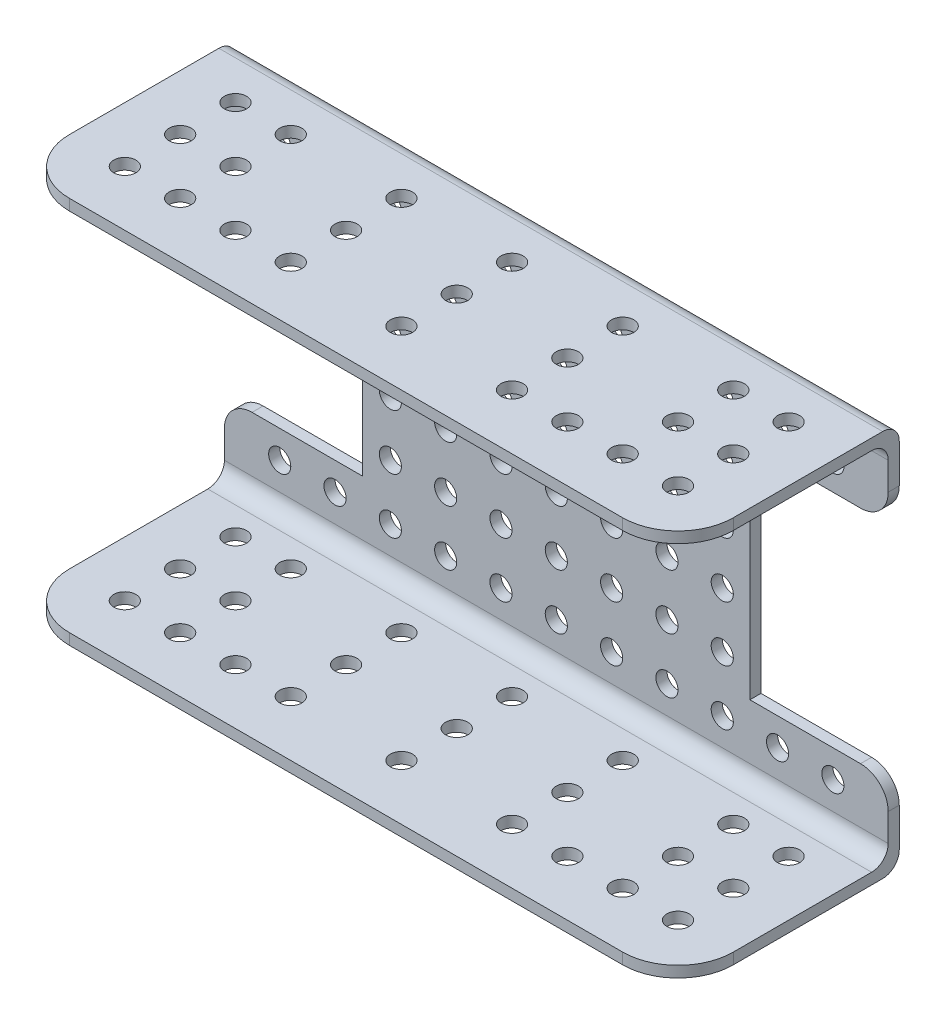
from build123d import *

# Parameters (mm, degrees)
Y_KSEKLIK_EKSTR_ZYON1_DEPTH = 2
IZIM2_W                     = 120
IZIM2_H                     = 2
Y_KSEKLIK_EKSTR_ZYON2_DEPTH = 38
RADYUS1_R                   = 10
RADYUS2_R                   = 5
IZIM3_R                     = 2
KES_EKSTR_ZYON1_DEPTH       = 2
RADYUS3_R                   = 3
IZIM4_R                     = 2
KES_EKSTR_ZYON2_DEPTH       = 101.498756211


with BuildPart() as part:
    # Çizim1 → Yükseklik-Ekstrüzyon1 (new body)
    with BuildSketch(Plane.XY):
        Polygon((-60, 20), (-35, 20), (-35, -20), (-60, -20), (-60, -35), (60, -35), (60, -20), (35, -20), (35, 20), (60, 20), (60, 35), (-60, 35), align=None)
    extrude(amount=Y_KSEKLIK_EKSTR_ZYON1_DEPTH)

    # Çizim2 → Yükseklik-Ekstrüzyon2 (add)
    with BuildSketch(Plane.XY.offset(2)):
        with Locations((0, 34)):
            Rectangle(IZIM2_W, IZIM2_H)
        with Locations((0, -34)):
            Rectangle(IZIM2_W, IZIM2_H)
    extrude(amount=Y_KSEKLIK_EKSTR_ZYON2_DEPTH)

    # Radyus1
    radyus1_edges = [part.edges().sort_by_distance(p)[0] for p in [
        (-60, 34, 40),
        (60, 34, 40),
        (60, -34, 40),
        (-60, -34, 40),
    ]]
    fillet(radyus1_edges, radius=RADYUS1_R)

    # Radyus2
    radyus2_edges = [part.edges().sort_by_distance(p)[0] for p in [
        (60, -20, 1),
        (60, 20, 1),
        (-60, -20, 1),
        (-60, 20, 1),
    ]]
    fillet(radyus2_edges, radius=RADYUS2_R)

    # Çizim3 → Kes-Ekstrüzyon1 (cut)
    with BuildSketch(Plane(origin=(0, 0, 0), x_dir=(-1, 0, 0), z_dir=(0, 0, -1))):
        with Locations((30, -25)):
            Circle(IZIM3_R)
        with Locations((40, -25)):
            Circle(IZIM3_R)
        with Locations((50, -25)):
            Circle(IZIM3_R)
        with Locations((20, -25)):
            Circle(IZIM3_R)
        with Locations((10, -25)):
            Circle(IZIM3_R)
        with Locations((0, -25)):
            Circle(IZIM3_R)
        with Locations((-10, -25)):
            Circle(IZIM3_R)
        with Locations((-20, -25)):
            Circle(IZIM3_R)
        with Locations((-30, -25)):
            Circle(IZIM3_R)
        with Locations((20, -15)):
            Circle(IZIM3_R)
        with Locations((10, -15)):
            Circle(IZIM3_R)
        with Locations((0, -15)):
            Circle(IZIM3_R)
        with Locations((-10, -15)):
            Circle(IZIM3_R)
        with Locations((-20, -15)):
            Circle(IZIM3_R)
        with Locations((-30, -15)):
            Circle(IZIM3_R)
        with Locations((20, -5)):
            Circle(IZIM3_R)
        with Locations((10, -5)):
            Circle(IZIM3_R)
        with Locations((0, -5)):
            Circle(IZIM3_R)
        with Locations((-10, -5)):
            Circle(IZIM3_R)
        with Locations((-20, -5)):
            Circle(IZIM3_R)
        with Locations((-30, -5)):
            Circle(IZIM3_R)
        with Locations((20, 5)):
            Circle(IZIM3_R)
        with Locations((10, 5)):
            Circle(IZIM3_R)
        with Locations((0, 5)):
            Circle(IZIM3_R)
        with Locations((-10, 5)):
            Circle(IZIM3_R)
        with Locations((-20, 5)):
            Circle(IZIM3_R)
        with Locations((-30, 5)):
            Circle(IZIM3_R)
        with Locations((20, 15)):
            Circle(IZIM3_R)
        with Locations((10, 15)):
            Circle(IZIM3_R)
        with Locations((0, 15)):
            Circle(IZIM3_R)
        with Locations((-10, 15)):
            Circle(IZIM3_R)
        with Locations((-20, 15)):
            Circle(IZIM3_R)
        with Locations((-30, 15)):
            Circle(IZIM3_R)
        with Locations((20, 25)):
            Circle(IZIM3_R)
        with Locations((10, 25)):
            Circle(IZIM3_R)
        with Locations((0, 25)):
            Circle(IZIM3_R)
        with Locations((-10, 25)):
            Circle(IZIM3_R)
        with Locations((-20, 25)):
            Circle(IZIM3_R)
        with Locations((-30, 25)):
            Circle(IZIM3_R)
        with Locations((30, -15)):
            Circle(IZIM3_R)
        with Locations((30, -5)):
            Circle(IZIM3_R)
        with Locations((30, 5)):
            Circle(IZIM3_R)
        with Locations((30, 15)):
            Circle(IZIM3_R)
        with Locations((30, 25)):
            Circle(IZIM3_R)
        with Locations((40, 25)):
            Circle(IZIM3_R)
        with Locations((50, 25)):
            Circle(IZIM3_R)
        with Locations((-40, 25)):
            Circle(IZIM3_R)
        with Locations((-50, 25)):
            Circle(IZIM3_R)
        with Locations((-40, -25)):
            Circle(IZIM3_R)
        with Locations((-50, -25)):
            Circle(IZIM3_R)
    extrude(amount=-KES_EKSTR_ZYON1_DEPTH, mode=Mode.SUBTRACT)

    # Radyus3
    radyus3_edges = [part.edges().sort_by_distance(p)[0] for p in [
        (0, 35, 0),
        (0, 33, 2),
        (0, -33, 2),
        (0, -35, 0),
    ]]
    fillet(radyus3_edges, radius=RADYUS3_R)

    # Çizim4 → Kes-Ekstrüzyon2 (cut, through all)
    with BuildSketch(Plane.XZ.offset(35)):
        with Locations(Location((0, 10, 0), (0, 0, 270))):
            Circle(IZIM4_R)
        with Locations(Location((20, 10, 0), (0, 0, 270))):
            Circle(IZIM4_R)
        with Locations(Location((40, 10, 0), (0, 0, 270))):
            Circle(IZIM4_R)
        with Locations(Location((20, 20, 0), (0, 0, 270))):
            Circle(IZIM4_R)
        with Locations(Location((40, 20, 0), (0, 0, 270))):
            Circle(IZIM4_R)
        with Locations(Location((20, 30, 0), (0, 0, 270))):
            Circle(IZIM4_R)
        with Locations(Location((40, 30, 0), (0, 0, 270))):
            Circle(IZIM4_R)
        with Locations(Location((0, 20, 0), (0, 0, 270))):
            Circle(IZIM4_R)
        with Locations(Location((0, 30, 0), (0, 0, 270))):
            Circle(IZIM4_R)
        with Locations(Location((-20, 10, 0), (0, 0, 270))):
            Circle(IZIM4_R)
        with Locations(Location((-40, 10, 0), (0, 0, 270))):
            Circle(IZIM4_R)
        with Locations(Location((-40, 20, 0), (0, 0, 270))):
            Circle(IZIM4_R)
        with Locations(Location((-40, 30, 0), (0, 0, 270))):
            Circle(IZIM4_R)
        with Locations(Location((-20, 20, 0), (0, 0, 270))):
            Circle(IZIM4_R)
        with Locations(Location((-20, 30, 0), (0, 0, 270))):
            Circle(IZIM4_R)
        with Locations(Location((30, 30, 0), (0, 0, 270))):
            Circle(IZIM4_R)
        with Locations(Location((-30, 30, 0), (0, 0, 270))):
            Circle(IZIM4_R)
        with Locations(Location((50, 10, 0), (0, 0, 270))):
            Circle(IZIM4_R)
        with Locations(Location((50, 20, 0), (0, 0, 270))):
            Circle(IZIM4_R)
        with Locations(Location((50, 30, 0), (0, 0, 270))):
            Circle(IZIM4_R)
        with Locations(Location((-50, 10, 0), (0, 0, 270))):
            Circle(IZIM4_R)
        with Locations(Location((-50, 20, 0), (0, 0, 270))):
            Circle(IZIM4_R)
        with Locations(Location((-50, 30, 0), (0, 0, 270))):
            Circle(IZIM4_R)
    extrude(amount=-KES_EKSTR_ZYON2_DEPTH, mode=Mode.SUBTRACT)


solid = part.part
